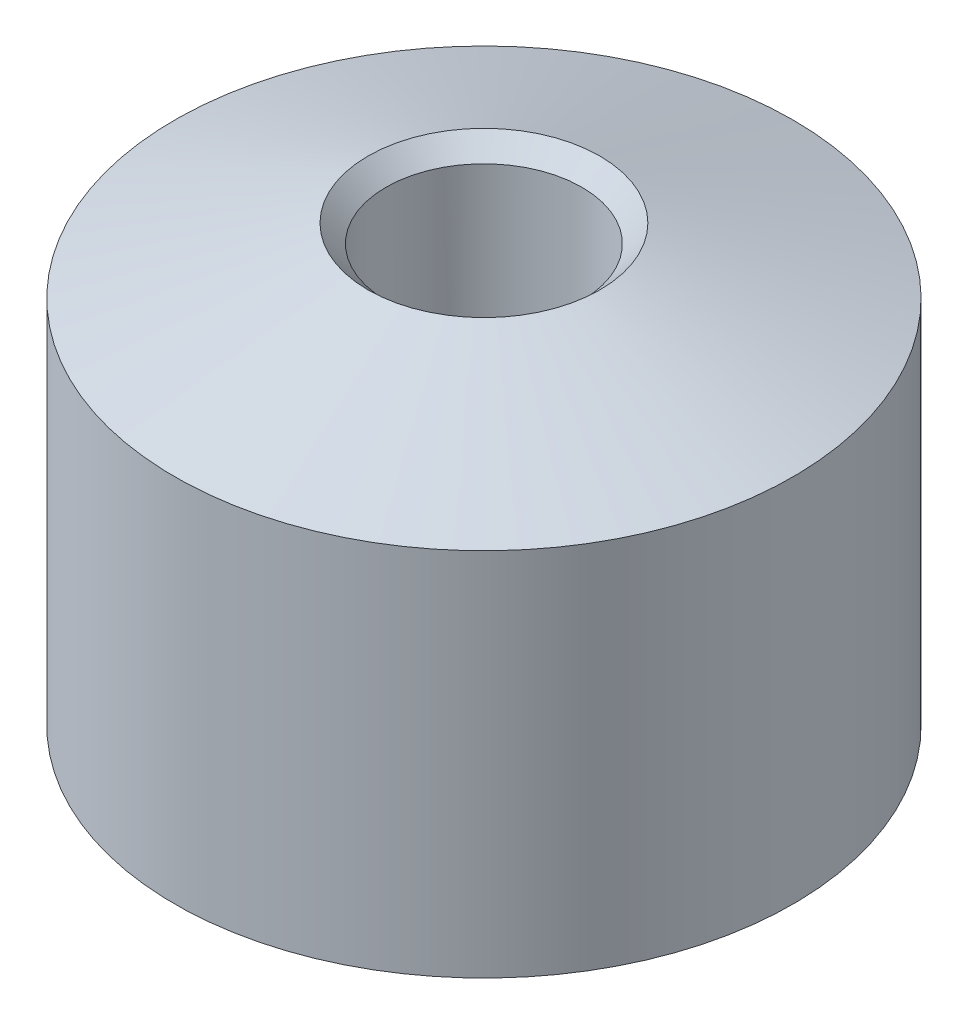
from build123d import *

# Parameters (mm, degrees)
SKETCH3_R          = 4
CUT_EXTRUDE1_DEPTH = 22
SKETCH4_R          = 4.5
CUT_EXTRUDE2_DEPTH = 32


with BuildPart() as part:
    # Sketch2 → Revolve1 (revolve)
    with BuildSketch(Plane.XY, mode=Mode.PRIVATE) as revolve1_sk:
        Polygon((-14.2, 18.5), (-4, 18.5), (-4, 37.173414273), (-5.326585727, 38.5), (-14.2, 35.5), align=None)
    revolve(revolve1_sk.sketch.rotate(Axis((0, 15.2, 0), (0, 1, 0)), 270), axis=Axis((0, 15.2, 0), (0, 1, 0)))

    # Sketch3 → Cut-Extrude1 (cut)
    with BuildSketch(Plane(origin=(0, 0, 0), x_dir=(0, 0, -1), z_dir=(1, 0, 0))):
        with Locations((0, 27.7)):
            Circle(SKETCH3_R)
    extrude(amount=-CUT_EXTRUDE1_DEPTH, mode=Mode.SUBTRACT)

    # Sketch4 → Cut-Extrude2 (cut)
    with BuildSketch(Plane.XZ.offset(-18.5)):
        with Locations(Location((0, 0, 0), (0, 0, 270))):
            Circle(SKETCH4_R)
    extrude(amount=-CUT_EXTRUDE2_DEPTH, mode=Mode.SUBTRACT)


solid = part.part
